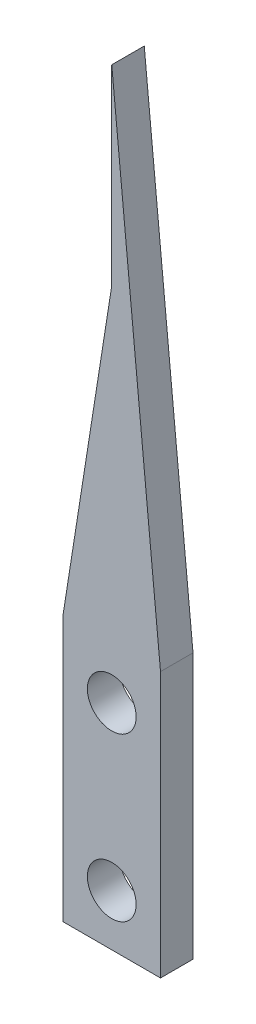
from build123d import *

# Parameters (mm, degrees)
SKETCH_1_R      = 1.5
EXTRUDE_1_DEPTH = 2


with BuildPart() as part:
    # 草图1 → 凸台-拉伸1 (new body)
    with BuildSketch(Plane.XY):
        Polygon((3, 3.164176285), (0, 34), (0, 22.228513357), (-3, 3.164176285), (-3, -13.164176285), (3, -13.164176285), align=None)
        Circle(SKETCH_1_R, mode=Mode.SUBTRACT)
        with Locations((0, -10)):
            Circle(SKETCH_1_R, mode=Mode.SUBTRACT)
    extrude(amount=EXTRUDE_1_DEPTH)


solid = part.part
